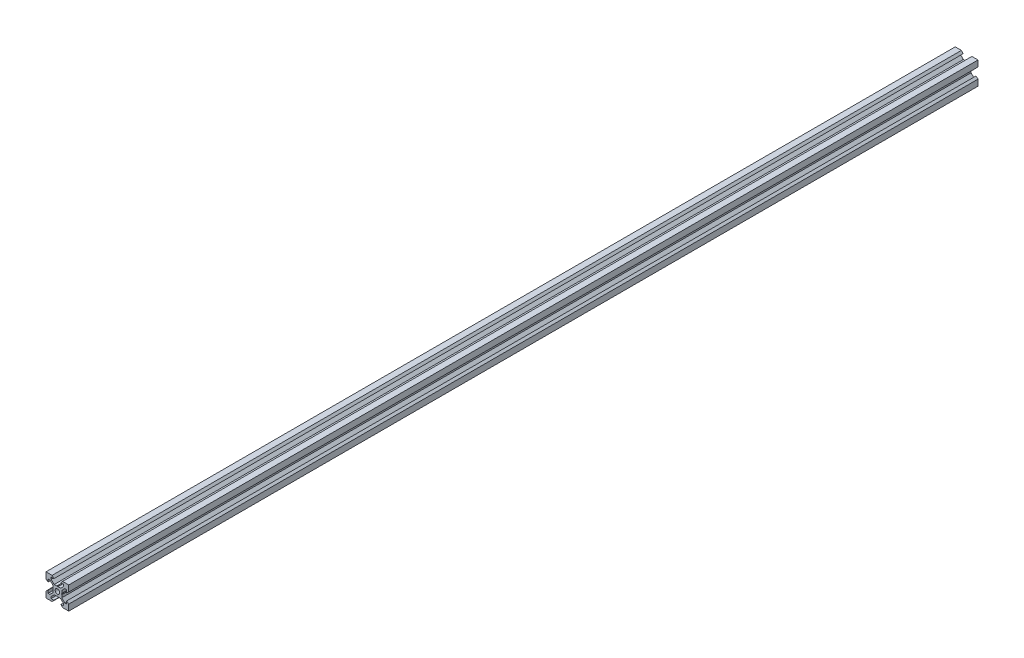
from build123d import *

# Parameters (mm, degrees)
SKETCH1_R           = 2
BOSS_EXTRUDE1_DEPTH = 400


with BuildPart() as part:
    # Sketch1 → Boss-Extrude1 (new, symmetric)
    with BuildSketch(Plane.XY):
        Polygon((10, 10), (10, 4.610379336), (8.2, 3.1), (8.2, 5.5), (6.560660172, 5.5), (3.9, 2.839339828), (3.9, 0.519615242), (3.6, 0), (3.9, -0.519615242), (3.9, -2.839339828), (6.560660172, -5.5), (8.2, -5.5), (8.2, -3.1), (10, -4.610379336), (10, -10), (4.610379336, -10), (3.1, -8.2), (5.5, -8.2), (5.5, -6.560660172), (2.839339828, -3.9), (0.519615242, -3.9), (0, -3.6), (-0.519615242, -3.9), (-2.839339828, -3.9), (-5.5, -6.560660172), (-5.5, -8.2), (-3.1, -8.2), (-4.610379336, -10), (-10, -10), (-10, -4.610379336), (-8.2, -3.1), (-8.2, -5.5), (-6.560660172, -5.5), (-3.9, -2.839339828), (-3.9, -0.519615242), (-3.6, 0), (-3.9, 0.519615242), (-3.9, 2.839339828), (-6.560660172, 5.5), (-8.2, 5.5), (-8.2, 3.1), (-10, 4.610379336), (-10, 10), (-4.610379336, 10), (-3.1, 8.2), (-5.5, 8.2), (-5.5, 6.560660172), (-2.839339828, 3.9), (-0.519615242, 3.9), (0, 3.6), (0.519615242, 3.9), (2.839339828, 3.9), (5.5, 6.560660172), (5.5, 8.2), (3.1, 8.2), (4.610379336, 10), align=None)
        Circle(SKETCH1_R, mode=Mode.SUBTRACT)
    extrude(amount=BOSS_EXTRUDE1_DEPTH, both=True)


solid = part.part
